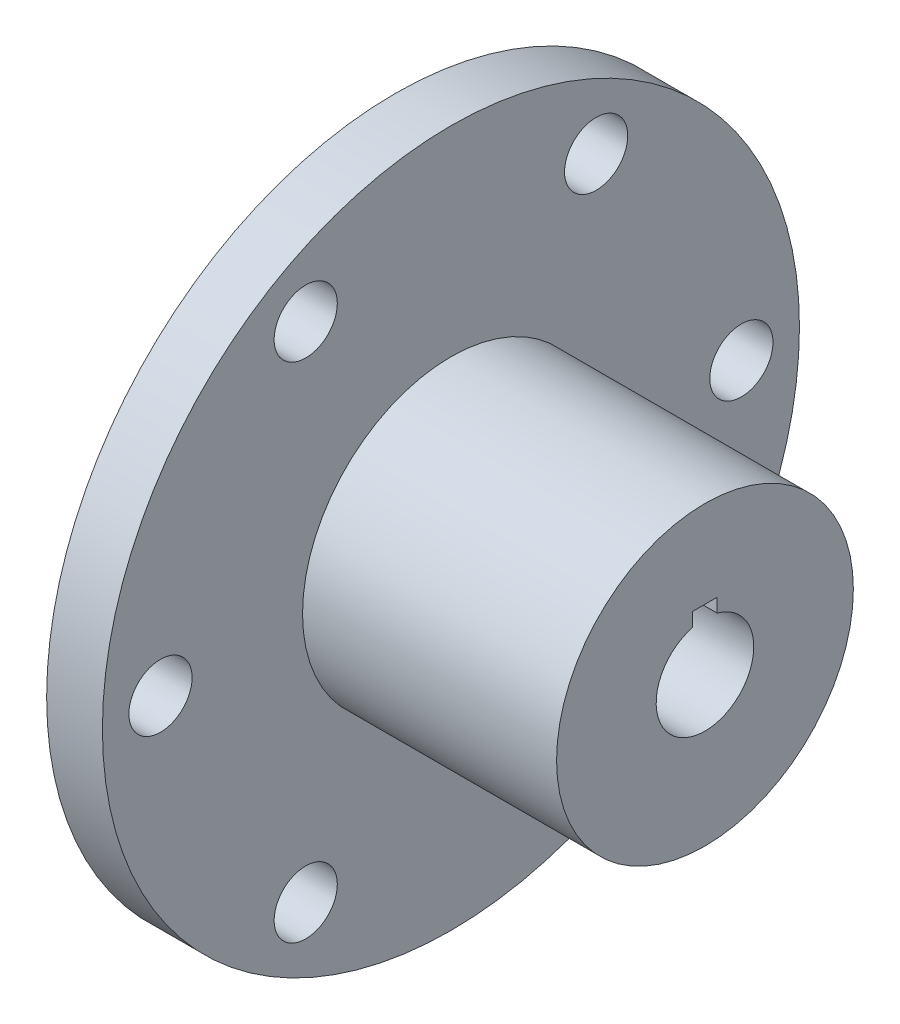
from build123d import *

# Parameters (mm, degrees)
SKETCH1_W           = 4.572
SKETCH1_H           = 28.575
SKETCH2_R           = 12.1666
BOSS_EXTRUDE1_DEPTH = 20.828
CUT_EXTRUDE1_DEPTH  = 48.730716001
SKETCH4_W           = 25.4
SKETCH4_H           = 4.0005
HOLE1_D             = 5.1816
HOLE1_DEPTH         = 25.4


with BuildPart() as part:
    # Sketch1 → Revolve1 (revolve)
    with BuildSketch(Plane.XY, mode=Mode.PRIVATE) as revolve1_sk:
        with Locations((-15.321066246, 14.2875)):
            Rectangle(SKETCH1_W, SKETCH1_H)
    revolve(revolve1_sk.sketch.rotate(Axis((-17.607066246, 0, 0), (1, 0, 0)), 270), axis=Axis((-17.607066246, 0, 0), (1, 0, 0)))

    # Sketch2 → Boss-Extrude1 (add)
    with BuildSketch(Plane(origin=(-13.035066246, 0, 0), x_dir=(0, 0, -1), z_dir=(1, 0, 0))):
        Circle(SKETCH2_R)
    extrude(amount=BOSS_EXTRUDE1_DEPTH)

    # Sketch3 → Cut-Extrude1 (cut, through all)
    with BuildSketch(Plane.ZY.offset(17.607066246)):
        with BuildLine():
            Line((1.0033, 3.872646299), (1.0033, 5.0038))
            Line((1.0033, 5.0038), (-1.0033, 5.0038))
            Line((-1.0033, 5.0038), (-1.0033, 3.872646299))
            ThreePointArc((-1.0033, 3.872646299), (0, 4.0005), (1.0033, 3.872646299))
        make_face()
    extrude(amount=-CUT_EXTRUDE1_DEPTH, mode=Mode.SUBTRACT)

    # Sketch4 → Cut-Revolve1 (revolve, cut)
    with BuildSketch(Plane(origin=(0, 0, 0), x_dir=(-1, 0, 0), z_dir=(0, 0, -1))):
        with Locations((4.907066246, 2.00025)):
            Rectangle(SKETCH4_W, SKETCH4_H)
    revolve(axis=Axis((7.792933754, 0, 0), (-1, 0, 0)), mode=Mode.SUBTRACT)

    # Hole1
    with Locations(Plane.ZY.offset(17.607066246)):
        with Locations((23.8125, 0), (11.90625, 20.622229928), (-11.90625, 20.622229928), (-23.8125, 0), (-11.90625, -20.622229928), (11.90625, -20.622229928)):
            Hole(HOLE1_D / 2, depth=HOLE1_DEPTH)


solid = part.part
